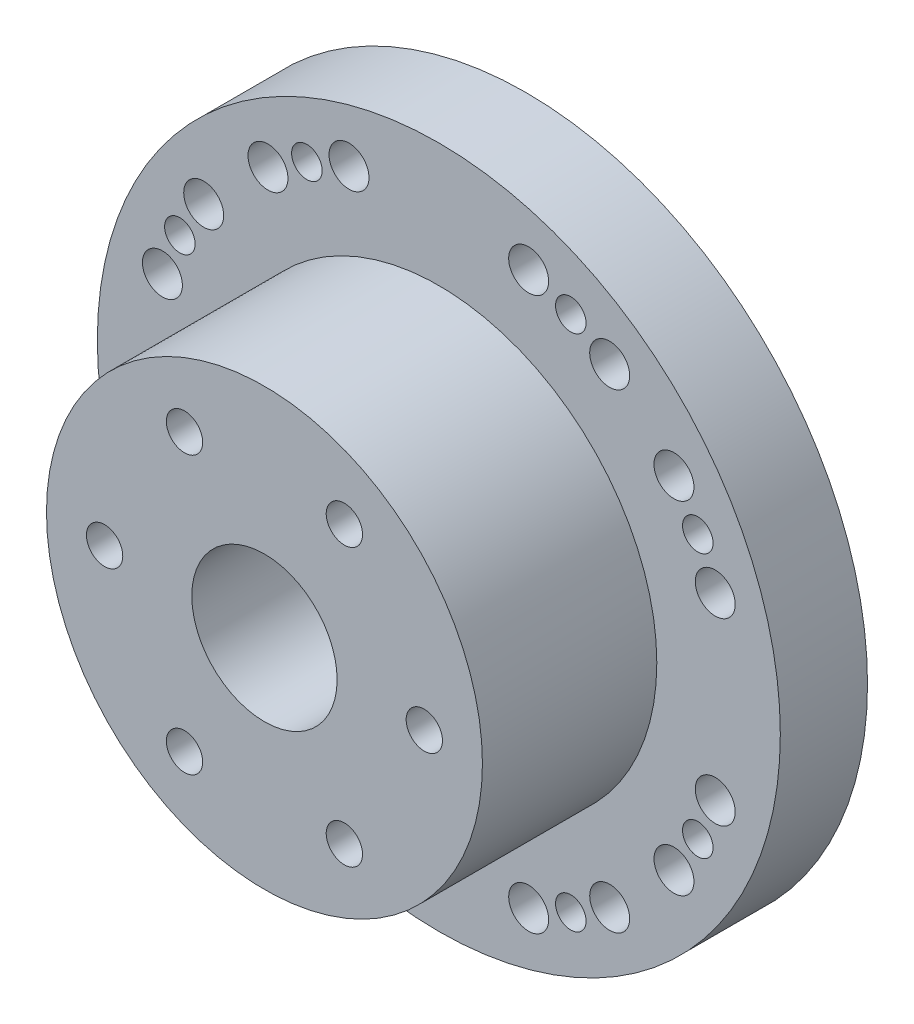
from build123d import *

# Parameters (mm, degrees)
SKETCH_1_R          = 47
EXTRUDE_1_DEPTH     = 12
SKETCH_2_R          = 30
EXTRUDE_2_DEPTH     = 36
SKETCH_3_R          = 10
CUT_EXTRUDE_1_DEPTH = 37
SKETCH_4_R          = 2.75
SKETCH_4_R_2        = 2.1
CUT_EXTRUDE_2_DEPTH = 13
SKETCH_5_R          = 2.5
CUT_EXTRUDE_3_DEPTH = 14


with BuildPart() as part:
    # 草图1 → 凸台-拉伸1 (new body)
    with BuildSketch(Plane.XY):
        Circle(SKETCH_1_R)
    extrude(amount=EXTRUDE_1_DEPTH)

    # 草图2 → 凸台-拉伸2 (add)
    with BuildSketch(Plane.XY):
        Circle(SKETCH_2_R)
    extrude(amount=EXTRUDE_2_DEPTH)

    # 草图3 → 切除-拉伸1 (cut)
    with BuildSketch(Plane(origin=(0, 0, 0), x_dir=(-1, 0, 0), z_dir=(0, 0, -1))):
        Circle(SKETCH_3_R)
    extrude(amount=-CUT_EXTRUDE_1_DEPTH, mode=Mode.SUBTRACT)

    # 草图4 → 切除-拉伸2 (cut)
    with BuildSketch(Plane(origin=(0, 0, 0), x_dir=(-1, 0, 0), z_dir=(0, 0, -1))):
        with Locations((-38.042994, -12.358424)):
            Circle(SKETCH_4_R)
        with Locations((-32.362074, -23.509491)):
            Circle(SKETCH_4_R)
        with Locations((-23.513329, -32.359286)):
            Circle(SKETCH_4_R)
        with Locations((-12.362935, -38.041528)):
            Circle(SKETCH_4_R)
        with Locations((12.358424, -38.042994)):
            Circle(SKETCH_4_R)
        with Locations((23.509491, -32.362074)):
            Circle(SKETCH_4_R)
        with Locations((32.359286, -23.513329)):
            Circle(SKETCH_4_R)
        with Locations((38.041528, -12.362935)):
            Circle(SKETCH_4_R)
        with Locations((38.042994, 12.358424)):
            Circle(SKETCH_4_R)
        with Locations((32.362074, 23.509491)):
            Circle(SKETCH_4_R)
        with Locations((23.513329, 32.359286)):
            Circle(SKETCH_4_R)
        with Locations((12.362935, 38.041528)):
            Circle(SKETCH_4_R)
        with Locations((-12.358424, 38.042994)):
            Circle(SKETCH_4_R)
        with Locations((-23.509491, 32.362074)):
            Circle(SKETCH_4_R)
        with Locations((-32.359286, 23.513329)):
            Circle(SKETCH_4_R)
        with Locations((-38.041528, 12.362935)):
            Circle(SKETCH_4_R)
        with Locations((-35.640260968, 18.15961999)):
            Circle(SKETCH_4_R_2)
        with Locations((-18.15961999, 35.640260968)):
            Circle(SKETCH_4_R_2)
        with Locations((18.15961999, 35.640260968)):
            Circle(SKETCH_4_R_2)
        with Locations((35.640260968, 18.15961999)):
            Circle(SKETCH_4_R_2)
        with Locations((35.640260968, -18.15961999)):
            Circle(SKETCH_4_R_2)
        with Locations((18.15961999, -35.640260968)):
            Circle(SKETCH_4_R_2)
        with Locations((-18.15961999, -35.640260968)):
            Circle(SKETCH_4_R_2)
        with Locations((-35.640260968, -18.15961999)):
            Circle(SKETCH_4_R_2)
    extrude(amount=-CUT_EXTRUDE_2_DEPTH, mode=Mode.SUBTRACT)

    # 草图5 → 切除-拉伸3 (cut)
    with BuildSketch(Plane.XY.offset(36)):
        with Locations((22, 0)):
            Circle(SKETCH_5_R)
        with Locations((11, 19.052558883)):
            Circle(SKETCH_5_R)
        with Locations((-11, 19.052558883)):
            Circle(SKETCH_5_R)
        with Locations((-22, 0)):
            Circle(SKETCH_5_R)
        with Locations((-11, -19.052558883)):
            Circle(SKETCH_5_R)
        with Locations((11, -19.052558883)):
            Circle(SKETCH_5_R)
    extrude(amount=-CUT_EXTRUDE_3_DEPTH, mode=Mode.SUBTRACT)


solid = part.part
